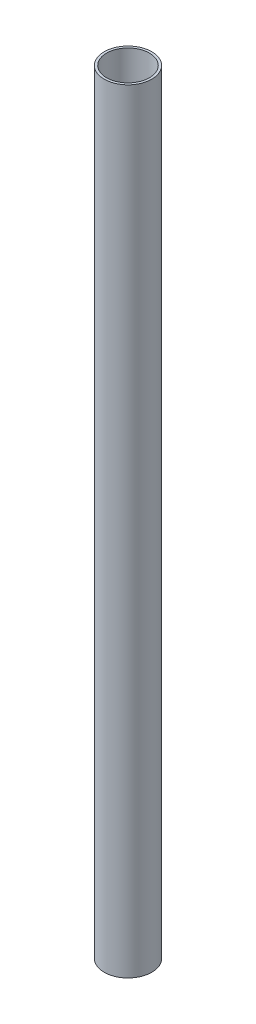
from build123d import *

# Parameters (mm, degrees)
SKETCH_1_R      = 10
SKETCH_1_R_2    = 9
EXTRUDE_1_DEPTH = 325


with BuildPart() as part:
    # 草图1 → 凸台-拉伸1 (new body)
    with BuildSketch(Plane(origin=(0, 0, 0), x_dir=(1, 0, 0), z_dir=(0, 1, 0))):
        with Locations(Location((0, 0, 0), (0, 0, 270))):
            Circle(SKETCH_1_R)
        with Locations(Location((0, 0, 0), (0, 0, 270))):
            Circle(SKETCH_1_R_2, mode=Mode.SUBTRACT)
    extrude(amount=EXTRUDE_1_DEPTH)


solid = part.part
